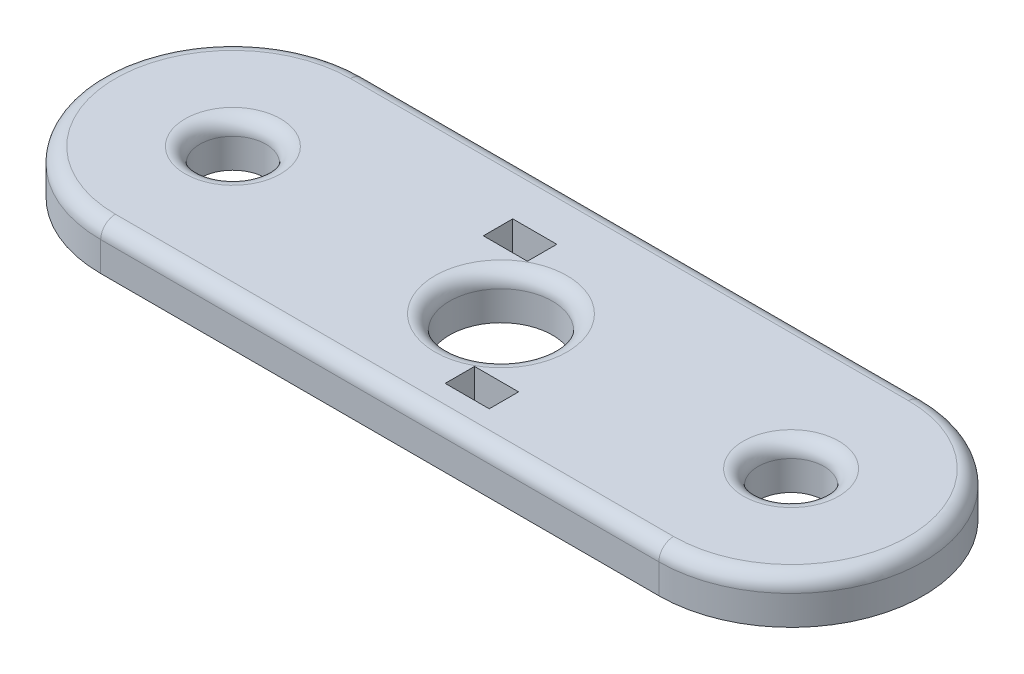
from build123d import *

# Parameters (mm, degrees)
SKETCH1_R               = 2.25
SKETCH1_R_2             = 3.5
BOSS_EXTRUDE1_DEPTH     = 3
CUT_EXTRUDE1_DEPTH      = 30.563490998
CUT_EXTRUDE1_DEPTH_BACK = 30.563490998
SKETCH2_W               = 3
SKETCH2_H               = 2
FILLET1_R               = 1


with BuildPart() as part:
    # Sketch1 → Boss-Extrude1 (new body)
    with BuildSketch(Plane(origin=(0, 0, 0), x_dir=(1, 0, 0), z_dir=(0, 1, 0))):
        with BuildLine():
            Line((19, 9), (-19, 9))
            ThreePointArc((-19, 9), (-28, 0), (-19, -9))
            Line((-19, -9), (19, -9))
            ThreePointArc((19, -9), (28, 0), (19, 9))
        make_face()
        with Locations(Location((-19, 0, 0), (0, 0, 270))):
            Circle(SKETCH1_R, mode=Mode.SUBTRACT)
        with Locations(Location((19, 0, 0), (0, 0, 270))):
            Circle(SKETCH1_R, mode=Mode.SUBTRACT)
        with Locations(Location((0, -0.75, 0), (0, 0, 270))):
            Circle(SKETCH1_R_2, mode=Mode.SUBTRACT)
    extrude(amount=BOSS_EXTRUDE1_DEPTH)

    # Sketch2 → Cut-Extrude1 (cut, two sides: drawn at the far end of the back side and taken through both)
    with BuildSketch(Plane.XZ.offset(-CUT_EXTRUDE1_DEPTH_BACK)):
        with Locations((3.7, 5.75)):
            Rectangle(SKETCH2_W, SKETCH2_H)
        with Locations((-3.7, -4.25)):
            Rectangle(SKETCH2_W, SKETCH2_H)
    extrude(amount=CUT_EXTRUDE1_DEPTH + CUT_EXTRUDE1_DEPTH_BACK, mode=Mode.SUBTRACT)

    # Fillet1
    fillet1_edges = [part.edges().sort_by_distance(p)[0] for p in [
        (-19, 3, -2.25),
        (28, 3, 0),
        (19, 3, -2.25),
        (0, 3, -9),
        (0, 3, -2.75),
        (-28, 3, 0),
        (0, 3, 9),
    ]]
    fillet(fillet1_edges, radius=FILLET1_R)


solid = part.part
